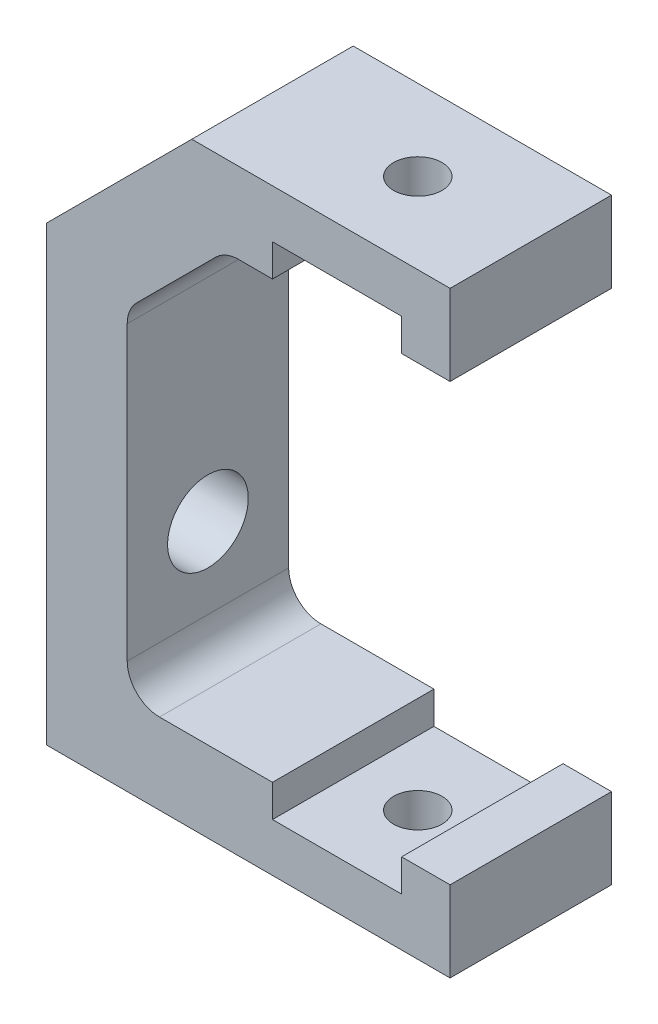
from build123d import *

# Parameters (mm, degrees)
BOSS_EXTRUDE1_DEPTH = 10
SKETCH2_R           = 1.5
CUT_EXTRUDE1_DEPTH  = 38
CUT_EXTRUDE2_REACH  = 47.76
SKETCH3_R           = 2.5


with BuildPart() as part:
    # Sketch1 → Boss-Extrude1 (new body)
    with BuildSketch(Plane.XY):
        with BuildLine():
            Line((0, 0), (25, 0))
            Line((25, 0), (25, 5))
            Line((25, 5), (22, 5))
            Line((22, 5), (22, 3))
            Line((22, 3), (14, 3))
            Line((14, 3), (14, 5))
            Line((14, 5), (7, 5))
            ThreePointArc((7, 5), (5.585786438, 5.585786438), (5, 7))
            Line((5, 7), (5, 25.100505063))
            ThreePointArc((5, 25.100505063), (5.152240935, 25.865871928), (5.585786438, 26.514718626))
            Line((5.585786438, 26.514718626), (10.485281374, 31.414213562))
            ThreePointArc((10.485281374, 31.414213562), (11.134128072, 31.847759065), (11.899494937, 32))
            Line((11.899494937, 32), (14, 32))
            Line((14, 32), (14, 34))
            Line((14, 34), (22, 34))
            Line((22, 34), (22, 32))
            Line((22, 32), (25, 32))
            Line((25, 32), (25, 37))
            Line((25, 37), (9, 37))
            Line((9, 37), (0, 28))
            Line((0, 28), (0, 0))
        make_face()
    extrude(amount=BOSS_EXTRUDE1_DEPTH)

    # Sketch2 → Cut-Extrude1 (cut)
    with BuildSketch(Plane(origin=(0, 37, 0), x_dir=(1, 0, 0), z_dir=(0, 1, 0))):
        with Locations(Location((18, -5, 0), (0, 0, 270))):
            Circle(SKETCH2_R)
    extrude(amount=-CUT_EXTRUDE1_DEPTH, mode=Mode.SUBTRACT)

    # Sketch3 → Cut-Extrude2 (cut, up to next)
    with BuildSketch(Plane.ZY, mode=Mode.PRIVATE) as cut_extrude2_sk1:
        with Locations((5, 12)):
            Circle(SKETCH3_R)
    cut_extrude2_tool1 = extrude(cut_extrude2_sk1.sketch, amount=-CUT_EXTRUDE2_REACH, mode=Mode.PRIVATE) & part.part
    add(cut_extrude2_tool1.solids().sort_by_distance((0, 12, 5))[0], mode=Mode.SUBTRACT)


solid = part.part
